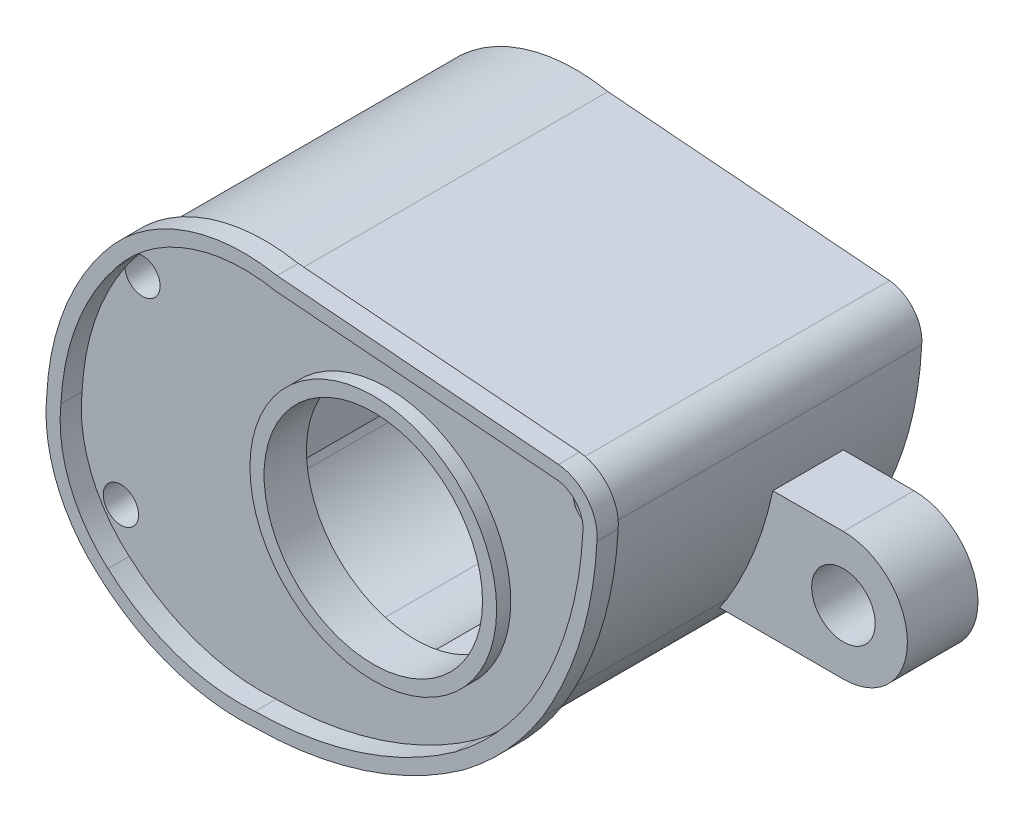
from build123d import *

# Parameters (mm, degrees)
SKETCH5_R           = 15.473305228
BOSS_EXTRUDE2_DEPTH = 44
SKETCH12_R          = 17.473305228
SKETCH12_R_2        = 15.473305228
EXTRUDE_THIN3_DEPTH = 2
CUT_EXTRUDE1_DEPTH  = 40
SKETCH20_R          = 2.5
CUT_EXTRUDE4_DEPTH  = 5
SKETCH21_R          = 1.5
CUT_EXTRUDE5_DEPTH  = 10
EXTRUDE_THIN4_DEPTH = 3
SKETCH25_R          = 9.063523101
SKETCH25_R_2        = 4.5
BOSS_EXTRUDE4_DEPTH = 10
BOSS_EXTRUDE5_DEPTH = 10


with BuildPart() as part:
    # Sketch5 → Boss-Extrude2 (new body)
    with BuildSketch(Plane.XY):
        with BuildLine():
            Line((32.256739142, 28.309407593), (-7.64388079, 31.541344196))
            ThreePointArc((-7.64388079, 31.541344196), (-20.714496622, 30.419301273), (-31.22672033, 22.571172119))
            ThreePointArc((-31.22672033, 22.571172119), (-36.818780536, 12.696442206), (-39.126744744, 1.585423828))
            ThreePointArc((-39.126744744, 1.585423828), (-37.806199642, -8.134094121), (-32.121617791, -16.127741455))
            ThreePointArc((-32.121617791, -16.127741455), (-22.11279616, -22.017790129), (-10.593480584, -23.492426514))
            ThreePointArc((-10.593480584, -23.492426514), (4.580349487, -21.025233446), (18.305750373, -14.10096228))
            ThreePointArc((18.305750373, -14.10096228), (24.300474949, -8.686492062), (29.222071174, -2.280939697))
            ThreePointArc((29.222071174, -2.280939697), (34.556349639, 9.723965473), (36.807215217, 22.666371704))
            ThreePointArc((36.807215217, 22.666371704), (35.700688178, 26.430324101), (32.256739142, 28.309407593))
        make_face()
        with Locations((5.124956693, 6.135695376)):
            Circle(SKETCH5_R, mode=Mode.SUBTRACT)
    extrude(amount=BOSS_EXTRUDE2_DEPTH)

    # Sketch12 → Extrude-Thin3 (add)
    with BuildSketch(Plane.XY.offset(44)):
        with Locations((5.124956693, 6.135695376)):
            Circle(SKETCH12_R)
        with Locations((5.124956693, 6.135695376)):
            Circle(SKETCH12_R_2, mode=Mode.SUBTRACT)
    extrude(amount=EXTRUDE_THIN3_DEPTH)

    # Sketch16 → Cut-Extrude1 (cut)
    with BuildSketch(Plane(origin=(0, 0, 0), x_dir=(-1, 0, 0), z_dir=(0, 0, -1))):
        with BuildLine():
            Line((22.195471785, 22.948681705), (21.19553282, 24.948682404))
            Line((21.19553282, 24.948682404), (-31.552515336, 24.948682404))
            Line((-31.552515336, 24.948682404), (-31.552515336, 12.688177276))
            ThreePointArc((-31.552515336, 12.688177276), (-30.470262259, 11.403706176), (-29.631188371, 9.948682897))
            Line((-29.631188371, 9.948682897), (-25.55269716, 9.948682897))
            Line((-25.55269716, 9.948682897), (-15.553124406, -13.051317103))
            Line((-15.553124406, -13.051317103), (-4.053551652, -13.051317103))
            ThreePointArc((-4.053551652, -13.051317103), (2.244172832, -18.564410088), (10.485205672, -20.0275935))
            ThreePointArc((10.485205672, -20.0275935), (19.095948524, -17.571925714), (25.191809676, -11.0132922))
            ThreePointArc((25.191809676, -11.0132922), (25.412735131, -10.540335552), (25.595374129, -10.051317103))
            Line((25.595374129, -10.051317103), (24.555518172, 3.874317282))
            Line((24.555518172, 3.874317282), (24.111182234, 7.873233908))
            Line((24.111182234, 7.873233908), (23.369788191, 11.870123022))
            Line((23.369788191, 11.870123022), (22.595496199, 14.948681944))
            Line((22.595496199, 14.948681944), (22.195471785, 20.94868409))
            Line((22.195471785, 20.94868409), (22.195471785, 22.948681705))
        make_face()
    extrude(amount=-CUT_EXTRUDE1_DEPTH, mode=Mode.SUBTRACT)

    # Sketch20 → Cut-Extrude4 (cut)
    with BuildSketch(Plane.XY.offset(44)):
        with Locations((33.960691328, 23.464138043)):
            Circle(SKETCH20_R)
        with Locations((-29.578532791, 19.955369365)):
            Circle(SKETCH20_R)
        with Locations((-32.62963599, -9.640331665)):
            Circle(SKETCH20_R)
    extrude(amount=-CUT_EXTRUDE4_DEPTH, mode=Mode.SUBTRACT)

    # Sketch21 → Cut-Extrude5 (cut)
    with BuildSketch(Plane.XY.offset(39)):
        with Locations((33.960691328, 23.464138043)):
            Circle(SKETCH21_R)
        with Locations((-29.578532791, 19.955369365)):
            Circle(SKETCH21_R)
        with Locations((-32.62963599, -9.640331665)):
            Circle(SKETCH21_R)
    extrude(amount=-CUT_EXTRUDE5_DEPTH, mode=Mode.SUBTRACT)

    # Sketch22 → Extrude-Thin4 (add)
    with BuildSketch(Plane.XY.offset(44)):
        with BuildLine():
            ThreePointArc((37.804637591, 22.589570952), (36.465446402, 27.074948387), (32.349832306, 29.305142187))
            Line((32.349832306, 29.305142187), (-7.508152433, 32.533625355))
            ThreePointArc((-7.508152433, 32.533625355), (-21.0919102, 31.345630531), (-32.016062598, 23.185195421))
            ThreePointArc((-32.016062598, 23.185195421), (-37.751325392, 13.057617284), (-40.124101539, 1.663276075))
            ThreePointArc((-40.124101539, 1.663276075), (-38.732987991, -8.509770105), (-32.783055883, -16.877826833))
            ThreePointArc((-32.783055883, -16.877826833), (-22.446887925, -22.960392779), (-10.552022778, -24.492110653))
            ThreePointArc((-10.552022778, -24.492110653), (4.910897112, -21.969287876), (18.896663991, -14.907783002))
            ThreePointArc((18.896663991, -14.907783002), (25.035055299, -9.365013776), (30.073165065, -2.806081812))
            ThreePointArc((30.073165065, -2.806081812), (35.507374746, 9.414237288), (37.804637591, 22.589570952))
        make_face()
        with BuildLine():
            ThreePointArc((35.809903928, 22.745746473), (34.934653853, 25.78714501), (32.162368837, 27.313776446))
            Line((32.162368837, 27.313776446), (-7.780775078, 30.549157478))
            ThreePointArc((-7.780775078, 30.549157478), (-20.337586242, 29.492756605), (-30.437333452, 21.957201169))
            ThreePointArc((-30.437333452, 21.957201169), (-35.886275494, 12.335154333), (-38.129381097, 1.507262942))
            ThreePointArc((-38.129381097, 1.507262942), (-36.879366836, -7.758521051), (-31.460237604, -15.377597571))
            ThreePointArc((-31.460237604, -15.377597571), (-21.778858305, -21.07513046), (-10.635186571, -22.492722237))
            ThreePointArc((-10.635186571, -22.492722237), (4.249673531, -20.08121001), (17.714822717, -13.294148135))
            ThreePointArc((17.714822717, -13.294148135), (23.565896834, -8.007967929), (28.370986318, -1.755777548))
            ThreePointArc((28.370986318, -1.755777548), (33.605695031, 10.034938826), (35.809903928, 22.745746473))
        make_face(mode=Mode.SUBTRACT)
    extrude(amount=EXTRUDE_THIN4_DEPTH)


with BuildPart() as body_2:
    # Sketch25 → Boss-Extrude4 (new body)
    with BuildSketch(Plane.XY.offset(20)):
        with Locations(Location((45.722016575, 5.199127346, 0), (0, 0, 180))):
            Circle(SKETCH25_R)
        with Locations(Location((45.722016575, 5.199127346, 0), (0, 0, 180))):
            Circle(SKETCH25_R_2, mode=Mode.SUBTRACT)
    extrude(amount=-BOSS_EXTRUDE4_DEPTH)

    # Sketch26 → Boss-Extrude5 (add)
    with BuildSketch(Plane.XY.offset(20)):
        with BuildLine():
            Line((45.722016575, 14.262650447), (35.722016575, 14.262650447))
            ThreePointArc((35.722016575, 14.262650447), (32.795294741, 4.845637931), (28.17132041, -3.864395755))
            Line((28.17132041, -3.864395755), (45.722016575, -3.864395755))
            ThreePointArc((45.722016575, -3.864395755), (36.658493473, 5.199127346), (45.722016575, 14.262650447))
        make_face()
    extrude(amount=-BOSS_EXTRUDE5_DEPTH)


solid = Compound([part.part, body_2.part])
